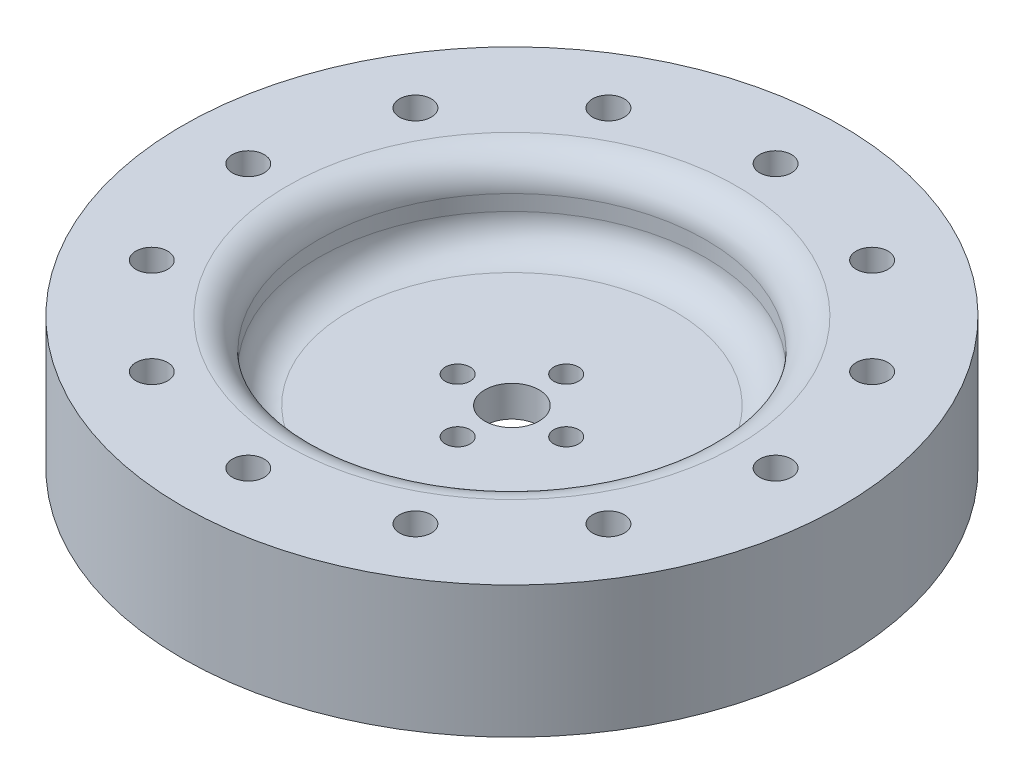
from build123d import *

# Parameters (mm, degrees)
SKETCH_1_R          = 42.5
SKETCH_1_R_2        = 2.05
SKETCH_1_R_3        = 1.6
SKETCH_1_R_4        = 3.5
EXTRUDE_1_DEPTH     = 17
SKETCH_2_R          = 25
CUT_EXTRUDE_1_DEPTH = 10
FILLET_1_R          = 4
SKETCH_3_R          = 12
CUT_EXTRUDE_2_DEPTH = 3


with BuildPart() as part:
    # 草图1 → 凸台-拉伸1 (new body)
    with BuildSketch(Plane(origin=(0, 0, 0), x_dir=(1, 0, 0), z_dir=(0, 1, 0))):
        with Locations(Location((0, 0, 0), (0, 0, 270))):
            Circle(SKETCH_1_R)
        with Locations(Location((34, 0, 0), (0, 0, 270))):
            Circle(SKETCH_1_R_2, mode=Mode.SUBTRACT)
        with Locations(Location((29.444863729, -17, 0), (0, 0, 270))):
            Circle(SKETCH_1_R_2, mode=Mode.SUBTRACT)
        with Locations(Location((17, -29.444863729, 0), (0, 0, 270))):
            Circle(SKETCH_1_R_2, mode=Mode.SUBTRACT)
        with Locations(Location((0, -34, 0), (0, 0, 270))):
            Circle(SKETCH_1_R_2, mode=Mode.SUBTRACT)
        with Locations(Location((-17, -29.444863729, 0), (0, 0, 270))):
            Circle(SKETCH_1_R_2, mode=Mode.SUBTRACT)
        with Locations(Location((-29.444863729, -17, 0), (0, 0, 270))):
            Circle(SKETCH_1_R_2, mode=Mode.SUBTRACT)
        with Locations(Location((-34, 0, 0), (0, 0, 270))):
            Circle(SKETCH_1_R_2, mode=Mode.SUBTRACT)
        with Locations(Location((-29.444863729, 17, 0), (0, 0, 270))):
            Circle(SKETCH_1_R_2, mode=Mode.SUBTRACT)
        with Locations(Location((-17, 29.444863729, 0), (0, 0, 270))):
            Circle(SKETCH_1_R_2, mode=Mode.SUBTRACT)
        with Locations(Location((0, 34, 0), (0, 0, 270))):
            Circle(SKETCH_1_R_2, mode=Mode.SUBTRACT)
        with Locations(Location((17, 29.444863729, 0), (0, 0, 270))):
            Circle(SKETCH_1_R_2, mode=Mode.SUBTRACT)
        with Locations(Location((29.444863729, 17, 0), (0, 0, 270))):
            Circle(SKETCH_1_R_2, mode=Mode.SUBTRACT)
        with Locations(Location((7, 0, 0), (0, 0, 270))):
            Circle(SKETCH_1_R_3, mode=Mode.SUBTRACT)
        with Locations(Location((0, -7, 0), (0, 0, 270))):
            Circle(SKETCH_1_R_3, mode=Mode.SUBTRACT)
        with Locations(Location((-7, 0, 0), (0, 0, 270))):
            Circle(SKETCH_1_R_3, mode=Mode.SUBTRACT)
        with Locations(Location((0, 7, 0), (0, 0, 270))):
            Circle(SKETCH_1_R_3, mode=Mode.SUBTRACT)
        with Locations(Location((0, 0, 0), (0, 0, 270))):
            Circle(SKETCH_1_R_4, mode=Mode.SUBTRACT)
    extrude(amount=EXTRUDE_1_DEPTH)

    # 草图2 → 切除-拉伸1 (cut)
    with BuildSketch(Plane(origin=(0, 17, 0), x_dir=(1, 0, 0), z_dir=(0, 1, 0))):
        with Locations(Location((0, 0, 0), (0, 0, 270))):
            Circle(SKETCH_2_R)
    extrude(amount=-CUT_EXTRUDE_1_DEPTH, mode=Mode.SUBTRACT)

    # 圆角1
    fillet_1_edges = [part.edges().sort_by_distance(p)[0] for p in [
        (0, 7, -25),
        (0, 17, -25),
    ]]
    fillet(fillet_1_edges, radius=FILLET_1_R)

    # 草图3 → 切除-拉伸2 (cut)
    with BuildSketch(Plane.XZ):
        with Locations(Location((0, 0, 0), (0, 0, 270))):
            Circle(SKETCH_3_R)
    extrude(amount=-CUT_EXTRUDE_2_DEPTH, mode=Mode.SUBTRACT)


solid = part.part
